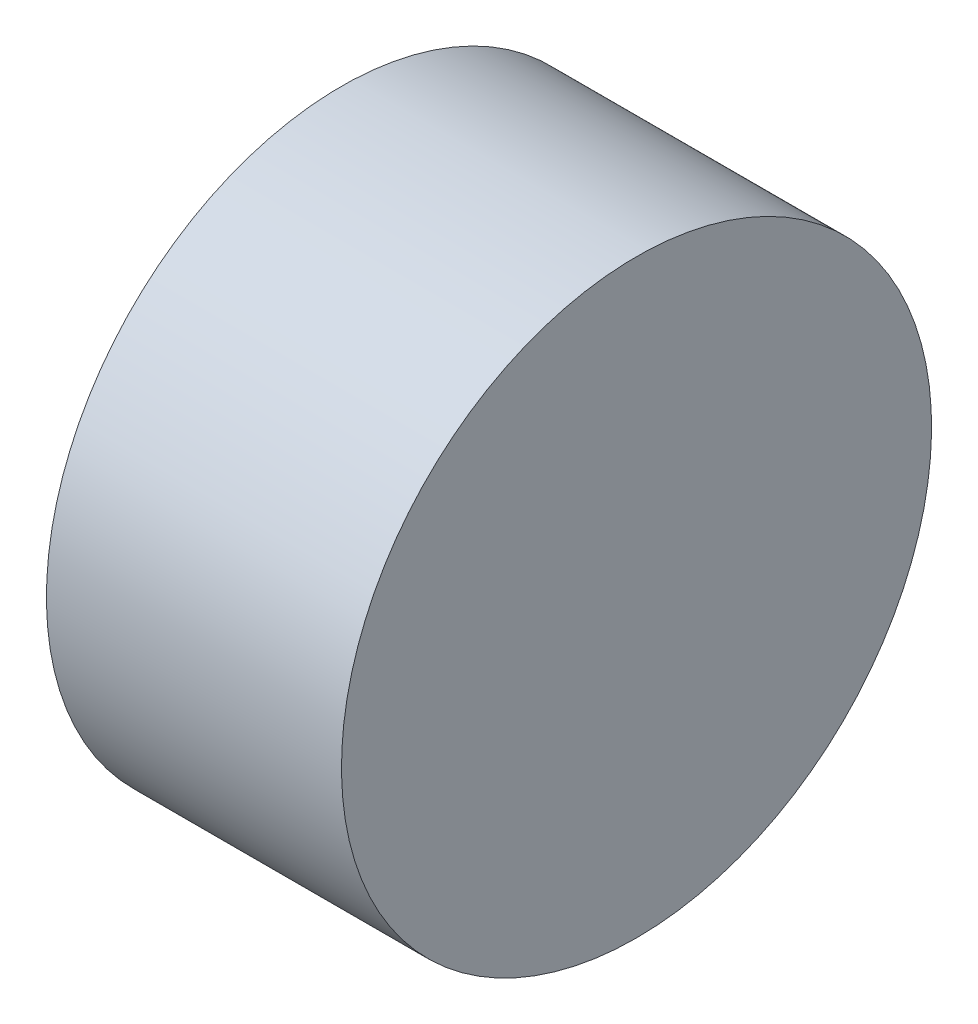
from build123d import *

# Parameters (mm, degrees)
SKETCH3_R      = 1.905
EXTRUDE2_DEPTH = 6.35


with BuildPart() as part:
    # Sketch2 → Revolve1 (revolve)
    with BuildSketch(Plane.XY):
        Polygon((50.8, -50.8), (50.8, 0), (15.24, 0), (15.24, -33.02), (0, -33.02), (0, -50.8), align=None)
    revolve(axis=Axis((15.24, 0, 0), (1, 0, 0)))


with BuildPart() as body_2:
    # Sketch3 → Extrude2 (new, symmetric)
    with BuildSketch(Plane.XY):
        with BuildLine():
            Line((-1.262293267, 10.577377717), (1.241294824, -8.196886969))
            ThreePointArc((1.241294824, -8.196886969), (-4.829986092, -13.898279258), (-2.590267125, -5.876435023))
            Line((-2.590267125, -5.876435023), (-2.590267125, 10.368385606))
            ThreePointArc((-2.590267125, 10.368385606), (-3.262426382, 18.962997383), (-1.262293267, 10.577377717))
        make_face()
        with Locations((-2.590267125, 14.691975292)):
            Circle(SKETCH3_R, mode=Mode.SUBTRACT)
        with Locations((-2.590267125, -10.200024708)):
            Circle(SKETCH3_R, mode=Mode.SUBTRACT)
    extrude(amount=EXTRUDE2_DEPTH, both=True)


with BuildPart() as body_3:
    # Sketch4 → Revolve2 (revolve)
    with BuildSketch(Plane.XY):
        with BuildLine():
            Line((-12.750267125, 7.351375292), (-12.750267125, -2.859424708))
            ThreePointArc((-12.750267125, -2.859424708), (-17.855667125, 2.245975292), (-12.750267125, 7.351375292))
        make_face()
    revolve(axis=Axis((-12.750267125, 7.351375292, 0), (0, -1, 0)))


solid = Compound([part.part, body_2.part, body_3.part])
